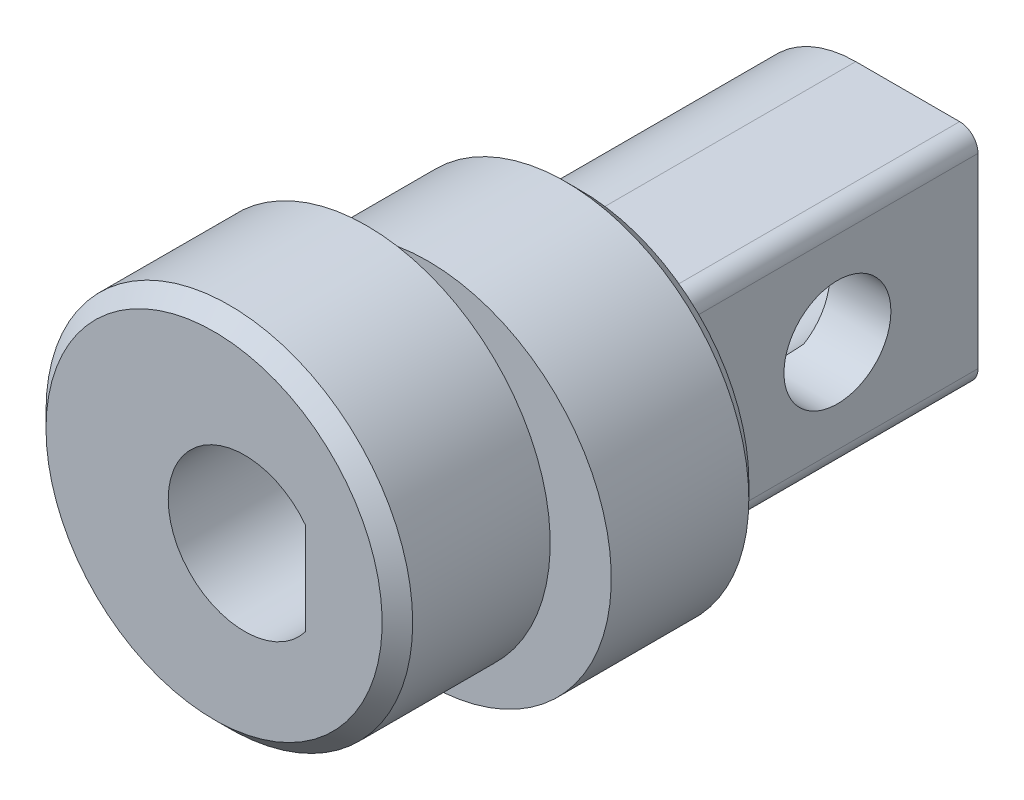
from build123d import *

# Parameters (mm, degrees)
SKETCH10_R                     = 6
BOSS_EXTRUDE4_DEPTH            = 5
BOSS_EXTRUDE5_DEPTH            = 10
SKETCH16_R                     = 6
BOSS_EXTRUDE6_DEPTH            = 5
CUT_EXTRUDE2_DEPTH             = 23.360679775
F_3_5_3_5_DIAMETER_HOLE0_D     = 3.5
F_3_5_3_5_DIAMETER_HOLE0_DEPTH = 4
F_3_5_3_5_DIAMETER_HOLE0_TIP   = 1.051506083
CHAMFER2_SIZE                  = 0.5


with BuildPart() as part:
    # Sketch10 → Boss-Extrude4 (new body)
    with BuildSketch(Plane.XY.offset(0.4)):
        Circle(SKETCH10_R)
    extrude(amount=BOSS_EXTRUDE4_DEPTH)

    # Sketch11 → Boss-Extrude5 (add)
    with BuildSketch(Plane(origin=(0, 0, 0.4), x_dir=(-1, 0, 0), z_dir=(0, 0, -1))):
        with BuildLine():
            Line((-3, -3.05), (-3, 3.05))
            ThreePointArc((-3, 3.05), (-2.824264069, 3.474264069), (-2.4, 3.65))
            Line((-2.4, 3.65), (1, 3.65))
            ThreePointArc((1, 3.65), (4.65, 0), (1, -3.65))
            Line((1, -3.65), (-2.4, -3.65))
            ThreePointArc((-2.4, -3.65), (-2.824264069, -3.474264069), (-3, -3.05))
        make_face()
    extrude(amount=BOSS_EXTRUDE5_DEPTH)

    # Sketch16 → Boss-Extrude6 (add)
    with BuildSketch(Plane(origin=(0, 0, 5.4), x_dir=(-1, 0, 0), z_dir=(0, 0, -1))):
        with Locations((2, 0)):
            Circle(SKETCH16_R)
    extrude(amount=-BOSS_EXTRUDE6_DEPTH)

    # Sketch17 → Cut-Extrude2 (cut, through all)
    with BuildSketch(Plane.XY.offset(-9.6)):
        with BuildLine():
            Line((1, -1.5), (1, 1.5))
            ThreePointArc((1, 1.5), (-3.5, 0), (1, -1.5))
        make_face()
    extrude(amount=CUT_EXTRUDE2_DEPTH, mode=Mode.SUBTRACT)

    # Ø3.5 (3.5) Diameter Hole0
    with Locations(Plane(origin=(3, 0, 0), x_dir=(0, 0, -1), z_dir=(1, 0, 0))):
        with Locations((5, 0)):
            Hole(F_3_5_3_5_DIAMETER_HOLE0_D / 2, depth=F_3_5_3_5_DIAMETER_HOLE0_DEPTH)
            with Locations((0, 0, -(F_3_5_3_5_DIAMETER_HOLE0_DEPTH + F_3_5_3_5_DIAMETER_HOLE0_TIP / 2))):  # 118° drill point
                Cone(0, F_3_5_3_5_DIAMETER_HOLE0_D / 2, F_3_5_3_5_DIAMETER_HOLE0_TIP, mode=Mode.SUBTRACT)

    # Chamfer2
    chamfer2_edges = [part.edges().sort_by_distance(p)[0] for p in [
        (-6, 0, 0.4),
        (4, 0, 10.4),
    ]]
    chamfer(chamfer2_edges, length=CHAMFER2_SIZE)


solid = part.part
